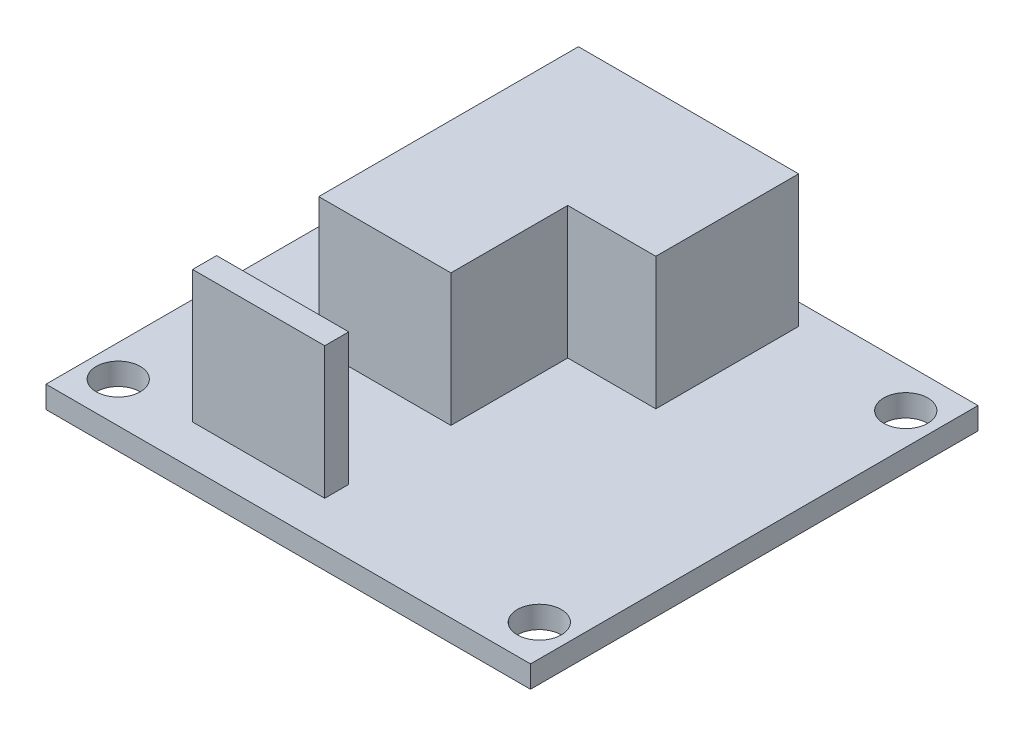
from build123d import *

# Parameters (mm, degrees)
SKETCH2_W             = 34.925
SKETCH2_H             = 32.258
SKETCH2_R             = 1.5875
SKETCH2_W_2           = 9.525
SKETCH2_H_2           = 1.73056427
BOSS_EXTRUDE1_DEPTH   = 1.5875
BOSS_EXTRUDE2_DEPTH   = 9.525
SKETCH3_W             = 9.525
SKETCH3_H             = 1.73056427
BOSS_EXTRUDE2_2_DEPTH = 9.525


with BuildPart() as part:
    # Sketch2 → Boss-Extrude1 (new body)
    with BuildSketch(Plane(origin=(0, 0, 0), x_dir=(1, 0, 0), z_dir=(0, 1, 0))):
        Rectangle(SKETCH2_W, SKETCH2_H)
        with Locations(Location((-15.1765, -13.208, 0), (0, 0, 270))):
            Circle(SKETCH2_R, mode=Mode.SUBTRACT)
        with Locations((-5.054257583, -12.342717865)):
            Rectangle(SKETCH2_W_2, SKETCH2_H_2, mode=Mode.SUBTRACT)
        with Locations(Location((15.1765, -13.208, 0), (0, 0, 270))):
            Circle(SKETCH2_R, mode=Mode.SUBTRACT)
        Polygon((-9.816757583, -4.112709283), (-9.816757583, 14.603812005), (-0.291757583, 14.603812005), (6.058242417, 14.603812005), (6.058242417, 4.309725297), (-0.291757583, 4.309725297), (-0.291757583, -4.112709283), align=None, mode=Mode.SUBTRACT)
        with Locations(Location((-15.1765, 13.208, 0), (0, 0, 270))):
            Circle(SKETCH2_R, mode=Mode.SUBTRACT)
        with Locations(Location((15.1765, 13.208, 0), (0, 0, 270))):
            Circle(SKETCH2_R, mode=Mode.SUBTRACT)
    extrude(amount=BOSS_EXTRUDE1_DEPTH)


with BuildPart() as body_2:
    # Sketch3 → Boss-Extrude2 (new body)
    with BuildSketch(Plane(origin=(0, 1.5875, 0), x_dir=(1, 0, 0), z_dir=(0, 1, 0))):
        Polygon((-9.816757583, 14.603812005), (6.058242417, 14.603812005), (6.058242417, 4.309725297), (-0.291757583, 4.309725297), (-0.291757583, -4.112709283), (-9.816757583, -4.112709283), align=None)
    extrude(amount=BOSS_EXTRUDE2_DEPTH)


with BuildPart() as body_3:
    # Sketch3 → Boss-Extrude2 2 (new body)
    with BuildSketch(Plane(origin=(0, 1.5875, 0), x_dir=(1, 0, 0), z_dir=(0, 1, 0))):
        with Locations((-5.054257583, -12.342717865)):
            Rectangle(SKETCH3_W, SKETCH3_H)
    extrude(amount=BOSS_EXTRUDE2_2_DEPTH)


solid = Compound([part.part, body_2.part, body_3.part])
